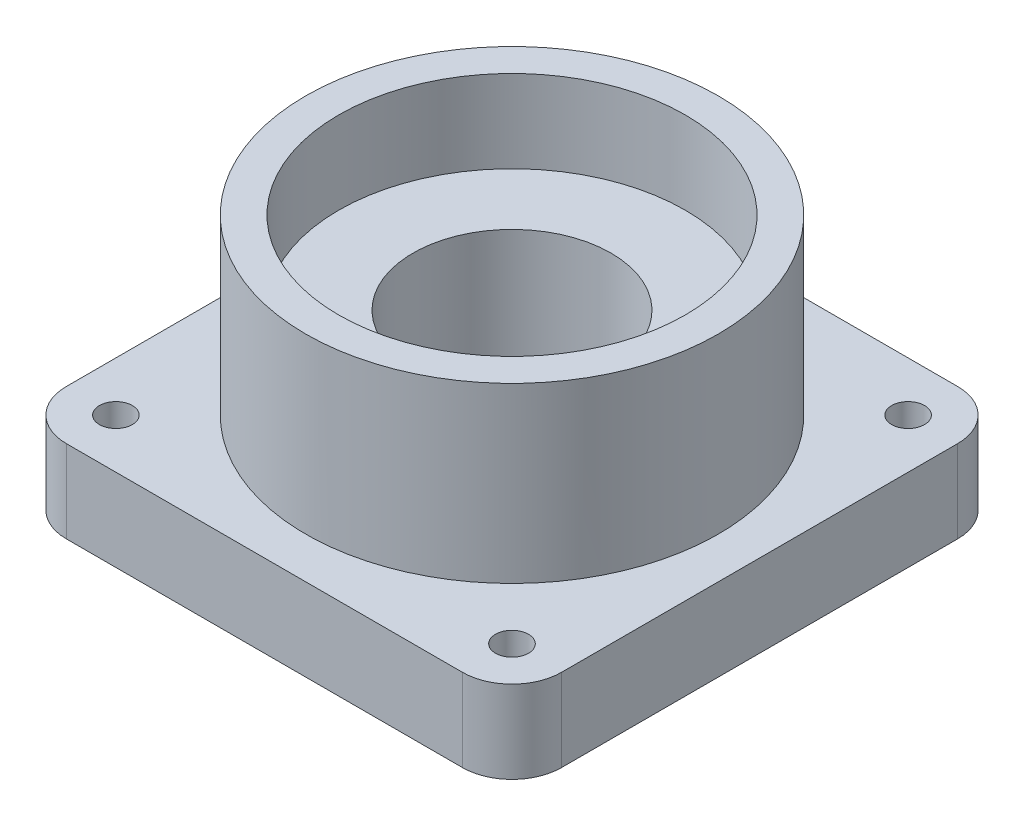
from build123d import *

# Parameters (mm, degrees)
SKETCH1_W           = 30
SKETCH1_H           = 30
BOSS_EXTRUDE1_DEPTH = 5
CUT_EXTRUDE1_REACH  = 23.794
SKETCH2_R           = 1
FILLET1_R           = 3
SKETCH3_R           = 12.5
BOSS_EXTRUDE2_DEPTH = 5.5
SKETCH4_R           = 12.5
SKETCH4_R_2         = 10.5
BOSS_EXTRUDE3_DEPTH = 5
CUT_EXTRUDE2_REACH  = 25.67
SKETCH5_R           = 6


with BuildPart() as part:
    # Sketch1 → Boss-Extrude1 (new body)
    with BuildSketch(Plane(origin=(0, 0, 0), x_dir=(1, 0, 0), z_dir=(0, 1, 0))):
        Rectangle(SKETCH1_W, SKETCH1_H)
    extrude(amount=BOSS_EXTRUDE1_DEPTH)

    # Sketch2 → Cut-Extrude1 (cut, up to next)
    with BuildSketch(Plane(origin=(0, 5, 0), x_dir=(1, 0, 0), z_dir=(0, 1, 0)), mode=Mode.PRIVATE) as cut_extrude1_sk1:
        with Locations(Location((-12, 12, 0), (0, 0, 270))):
            Circle(SKETCH2_R)
    cut_extrude1_tool1 = extrude(cut_extrude1_sk1.sketch, amount=-CUT_EXTRUDE1_REACH, mode=Mode.PRIVATE) & part.part
    # Sketch2 → Cut-Extrude1 (cut, up to next)
    with BuildSketch(Plane(origin=(0, 5, 0), x_dir=(1, 0, 0), z_dir=(0, 1, 0)), mode=Mode.PRIVATE) as cut_extrude1_sk2:
        with Locations(Location((12, 12, 0), (0, 0, 270))):
            Circle(SKETCH2_R)
    cut_extrude1_tool2 = extrude(cut_extrude1_sk2.sketch, amount=-CUT_EXTRUDE1_REACH, mode=Mode.PRIVATE) & part.part
    # Sketch2 → Cut-Extrude1 (cut, up to next)
    with BuildSketch(Plane(origin=(0, 5, 0), x_dir=(1, 0, 0), z_dir=(0, 1, 0)), mode=Mode.PRIVATE) as cut_extrude1_sk3:
        with Locations(Location((-12, -12, 0), (0, 0, 270))):
            Circle(SKETCH2_R)
    cut_extrude1_tool3 = extrude(cut_extrude1_sk3.sketch, amount=-CUT_EXTRUDE1_REACH, mode=Mode.PRIVATE) & part.part
    # Sketch2 → Cut-Extrude1 (cut, up to next)
    with BuildSketch(Plane(origin=(0, 5, 0), x_dir=(1, 0, 0), z_dir=(0, 1, 0)), mode=Mode.PRIVATE) as cut_extrude1_sk4:
        with Locations(Location((12, -12, 0), (0, 0, 270))):
            Circle(SKETCH2_R)
    cut_extrude1_tool4 = extrude(cut_extrude1_sk4.sketch, amount=-CUT_EXTRUDE1_REACH, mode=Mode.PRIVATE) & part.part
    add(cut_extrude1_tool1.solids().sort_by_distance((-12, 5, -12))[0], mode=Mode.SUBTRACT)
    add(cut_extrude1_tool2.solids().sort_by_distance((12, 5, -12))[0], mode=Mode.SUBTRACT)
    add(cut_extrude1_tool3.solids().sort_by_distance((-12, 5, 12))[0], mode=Mode.SUBTRACT)
    add(cut_extrude1_tool4.solids().sort_by_distance((12, 5, 12))[0], mode=Mode.SUBTRACT)

    # Fillet1
    fillet1_edges = [part.edges().sort_by_distance(p)[0] for p in [
        (15, 2.5, 15),
        (-15, 2.5, 15),
        (-15, 2.5, -15),
        (15, 2.5, -15),
    ]]
    fillet(fillet1_edges, radius=FILLET1_R)

    # Sketch3 → Boss-Extrude2 (add)
    with BuildSketch(Plane(origin=(0, 5, 0), x_dir=(1, 0, 0), z_dir=(0, 1, 0))):
        with Locations(Location((0, 0, 0), (0, 0, 90))):
            Circle(SKETCH3_R)
    extrude(amount=BOSS_EXTRUDE2_DEPTH)

    # Sketch4 → Boss-Extrude3 (add)
    with BuildSketch(Plane(origin=(0, 10.5, 0), x_dir=(1, 0, 0), z_dir=(0, 1, 0))):
        with Locations(Location((0, 0, 0), (0, 0, 90))):
            Circle(SKETCH4_R)
        with Locations(Location((0, 0, 0), (0, 0, 270))):
            Circle(SKETCH4_R_2, mode=Mode.SUBTRACT)
    extrude(amount=BOSS_EXTRUDE3_DEPTH)

    # Sketch5 → Cut-Extrude2 (cut, up to next)
    with BuildSketch(Plane(origin=(0, 10.5, 0), x_dir=(1, 0, 0), z_dir=(0, 1, 0)), mode=Mode.PRIVATE) as cut_extrude2_sk1:
        with Locations(Location((0, 0, 0), (0, 0, 270))):
            Circle(SKETCH5_R)
    cut_extrude2_tool1 = extrude(cut_extrude2_sk1.sketch, amount=-CUT_EXTRUDE2_REACH, mode=Mode.PRIVATE) & part.part
    add(cut_extrude2_tool1.solids().sort_by_distance((0, 10.5, 0))[0], mode=Mode.SUBTRACT)


solid = part.part
